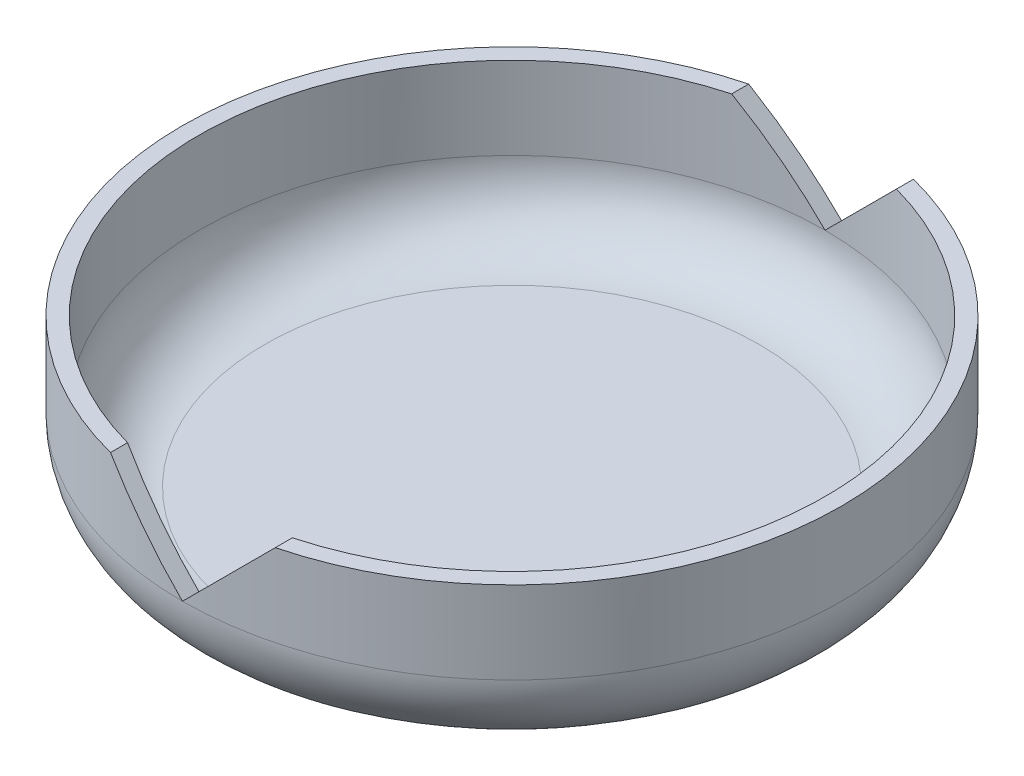
from build123d import *

# Parameters (mm, degrees)
SKETCH1_R               = 40
BOSS_EXTRUDE1_DEPTH     = 20
FILLET1_R               = 10
SHELL1_T                = -2
CUT_EXTRUDE1_DEPTH      = 61.000000133
CUT_EXTRUDE1_DEPTH_BACK = 61.000000133


with BuildPart() as part:
    # Sketch1 → Boss-Extrude1 (new body)
    with BuildSketch(Plane(origin=(0, 0, 0), x_dir=(1, 0, 0), z_dir=(0, 1, 0))):
        with Locations(Location((0, 0, 0), (0, 0, 270))):
            Circle(SKETCH1_R)
    extrude(amount=BOSS_EXTRUDE1_DEPTH)

    # Fillet1
    fillet1_edges = [part.edges().sort_by_distance(p)[0] for p in [
        (0, 0, -40),
    ]]
    fillet(fillet1_edges, radius=FILLET1_R)

    # Shell1
    shell1_openings = [part.faces().sort_by_distance(p)[0] for p in [
        (0, 20, 0),
    ]]
    offset(amount=SHELL1_T, openings=shell1_openings, kind=Kind.INTERSECTION)

    # Sketch2 → Cut-Extrude1 (cut, two sides: drawn at the far end of the back side and taken through both)
    with BuildSketch(Plane.XY.offset(-CUT_EXTRUDE1_DEPTH_BACK)):
        Polygon((-17.458737084, 27.458737084), (0, 10), (20.279769331, 30.279769331), align=None)
    extrude(amount=CUT_EXTRUDE1_DEPTH + CUT_EXTRUDE1_DEPTH_BACK, mode=Mode.SUBTRACT)


solid = part.part
